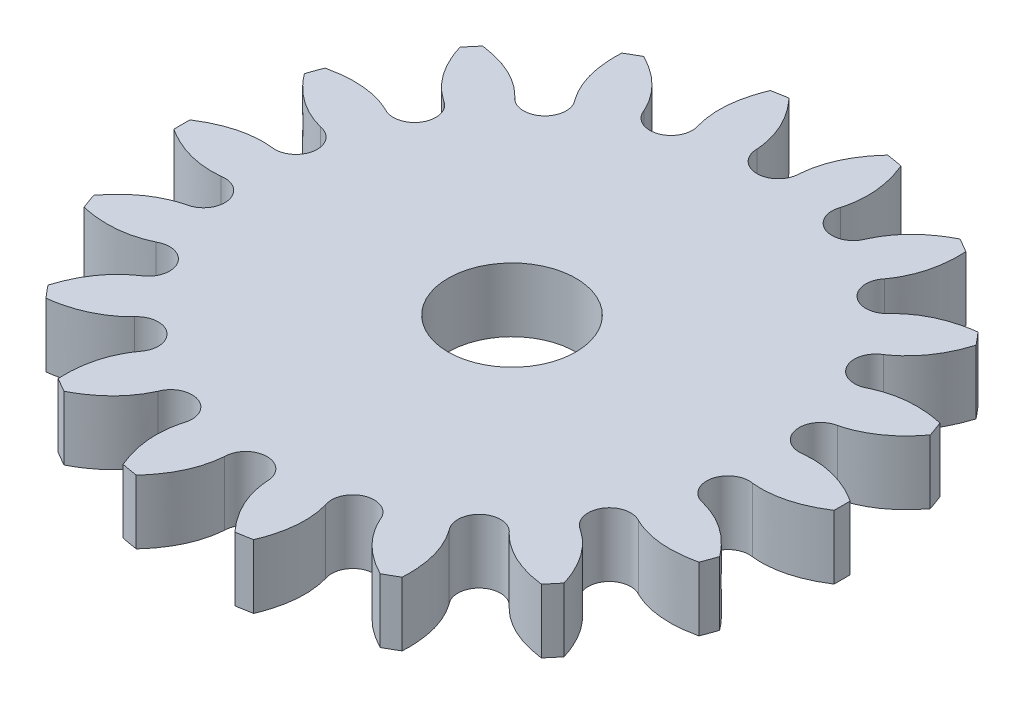
from build123d import *

# Parameters (mm, degrees)
SKETCH1_R           = 15.5
SKETCH1_R_2         = 3
BOSS_EXTRUDE1_DEPTH = 3
CUT_EXTRUDE3_START  = -3
CUT_EXTRUDE3_DEPTH  = 3
CIRPATTERN2_COUNT   = 18


with BuildPart() as part:
    # Sketch1 → Boss-Extrude1 (new body)
    with BuildSketch(Plane(origin=(0, 0, 0), x_dir=(1, 0, 0), z_dir=(0, 1, 0))):
        with Locations(Location((0, 0, 0), (0, 0, 270))):
            Circle(SKETCH1_R)
        with Locations(Location((0, 0, 0), (0, 0, 270))):
            Circle(SKETCH1_R_2, mode=Mode.SUBTRACT)
    extrude(amount=BOSS_EXTRUDE1_DEPTH)

    # Sketch3 → Cut-Extrude3 (cut)
    with BuildSketch(Plane(origin=(0, 3, 0), x_dir=(1, 0, 0), z_dir=(0, 1, 0)).offset(CUT_EXTRUDE3_START)):
        with BuildLine():
            ThreePointArc((-1, 12.5), (0, 11.5), (1, 12.5))
            add(Edge.make_bspline(
                [(2.316977637, 15.325847925), (1.117647531, 14.032764815), (1, 12.5)],
                knots=[0, 0, 0, 0.821337086, 0.821337086, 0.821337086], degree=2))
            ThreePointArc((2.316977637, 15.325847925), (0, 15.5), (-2.316977637, 15.325847925))
            add(Edge.make_bspline(
                [(-2.316977637, 15.325847925), (-1.117647531, 14.032764815), (-1, 12.5)],
                knots=[0, 0, 0, 0.821337086, 0.821337086, 0.821337086], degree=2))
        make_face()
    cut_extrude3 = extrude(amount=CUT_EXTRUDE3_DEPTH, mode=Mode.SUBTRACT)

    # CirPattern2: Cut-Extrude3 ×18 about axis
    cirpattern2_axis = Axis((0, 3, 0), (0, 1, 0))
    for i in range(1, CIRPATTERN2_COUNT):
        add(cut_extrude3.rotate(cirpattern2_axis, i * 360 / CIRPATTERN2_COUNT), mode=Mode.SUBTRACT)


solid = part.part
